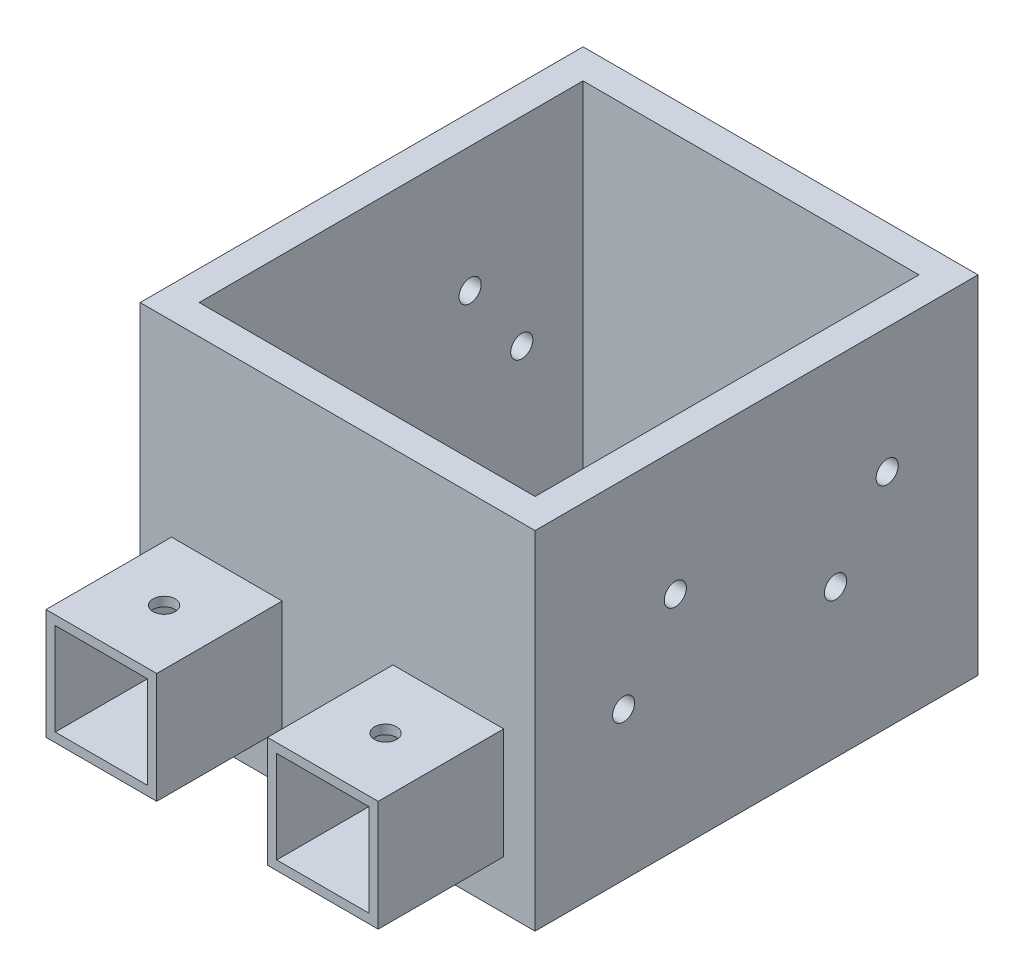
from build123d import *

# Parameters (mm, degrees)
SKETCH1_W           = 53.5
SKETCH1_H           = 60
SKETCH1_W_2         = 45.5
SKETCH1_H_2         = 52
BOSS_EXTRUDE1_DEPTH = 47
CUT_EXTRUDE1_START  = -4
SKETCH3_R           = 1.5
CUT_EXTRUDE1_DEPTH  = 82.273863628
LPATTERN1_COUNT     = 2
LPATTERN1_PITCH     = 28.7
SKETCH4_R           = 1.5
CUT_EXTRUDE2_DEPTH  = 4
LPATTERN2_COUNT     = 2
LPATTERN2_PITCH     = 28.7
SKETCH5_W           = 15
SKETCH5_H           = 15
SKETCH5_W_2         = 12.5
SKETCH5_H_2         = 12.5
BOSS_EXTRUDE2_DEPTH = 17
SKETCH6_R           = 1.5
CUT_EXTRUDE3_DEPTH  = 60.742904181


with BuildPart() as part:
    # Sketch1 → Boss-Extrude1 (new body)
    with BuildSketch(Plane(origin=(0, 0, 0), x_dir=(1, 0, 0), z_dir=(0, 1, 0))):
        Rectangle(SKETCH1_W, SKETCH1_H)
        Rectangle(SKETCH1_W_2, SKETCH1_H_2, mode=Mode.SUBTRACT)
    extrude(amount=BOSS_EXTRUDE1_DEPTH)

    # Sketch3 → Cut-Extrude1 (cut)
    with BuildSketch(Plane.ZY.offset(26.75).offset(CUT_EXTRUDE1_START)):
        with Locations(Location((18, 30.05, 0), (0, 0, 180))):
            Circle(SKETCH3_R)
        with Locations(Location((11, 20.05, 0), (0, 0, 180))):
            Circle(SKETCH3_R)
    cut_extrude1 = extrude(amount=CUT_EXTRUDE1_DEPTH, mode=Mode.SUBTRACT)

    # LPattern1: Cut-Extrude1 ×2
    with Locations(*[(0, 0, -i * LPATTERN1_PITCH) for i in range(1, LPATTERN1_COUNT)]):
        add(cut_extrude1, mode=Mode.SUBTRACT)

    # Sketch4 → Cut-Extrude2 (cut)
    with BuildSketch(Plane(origin=(26.75, 0, 0), x_dir=(0, 0, -1), z_dir=(1, 0, 0))):
        with Locations((-11, 30.05)):
            Circle(SKETCH4_R)
        with Locations((-18, 20.05)):
            Circle(SKETCH4_R)
    cut_extrude2 = extrude(amount=-CUT_EXTRUDE2_DEPTH, mode=Mode.SUBTRACT)

    # LPattern2: Cut-Extrude2 ×2
    with Locations(*[(0, 0, -i * LPATTERN2_PITCH) for i in range(1, LPATTERN2_COUNT)]):
        add(cut_extrude2, mode=Mode.SUBTRACT)

    # Sketch5 → Boss-Extrude2 (add)
    # profile 1 of 2: a face of its own
    with BuildSketch(Plane.XY.offset(30)):
        with Locations((-15, 14.11)):
            Rectangle(SKETCH5_W, SKETCH5_H)
        with Locations((-15, 14.11)):
            Rectangle(SKETCH5_W_2, SKETCH5_H_2, mode=Mode.SUBTRACT)
    # profile 2 of 2: a face of its own
    with BuildSketch(Plane.XY.offset(30)):
        with Locations((15, 14.11)):
            Rectangle(SKETCH5_W, SKETCH5_H)
        with Locations((15, 14.11)):
            Rectangle(SKETCH5_W_2, SKETCH5_H_2, mode=Mode.SUBTRACT)
    extrude(amount=BOSS_EXTRUDE2_DEPTH)

    # Sketch6 → Cut-Extrude3 (cut, through all)
    with BuildSketch(Plane(origin=(0, 21.61, 0), x_dir=(1, 0, 0), z_dir=(0, 1, 0))):
        with Locations(Location((-15, -38.5, 0), (0, 0, 270))):
            Circle(SKETCH6_R)
        with Locations(Location((15, -38.5, 0), (0, 0, 270))):
            Circle(SKETCH6_R)
    extrude(amount=-CUT_EXTRUDE3_DEPTH, mode=Mode.SUBTRACT)


solid = part.part
